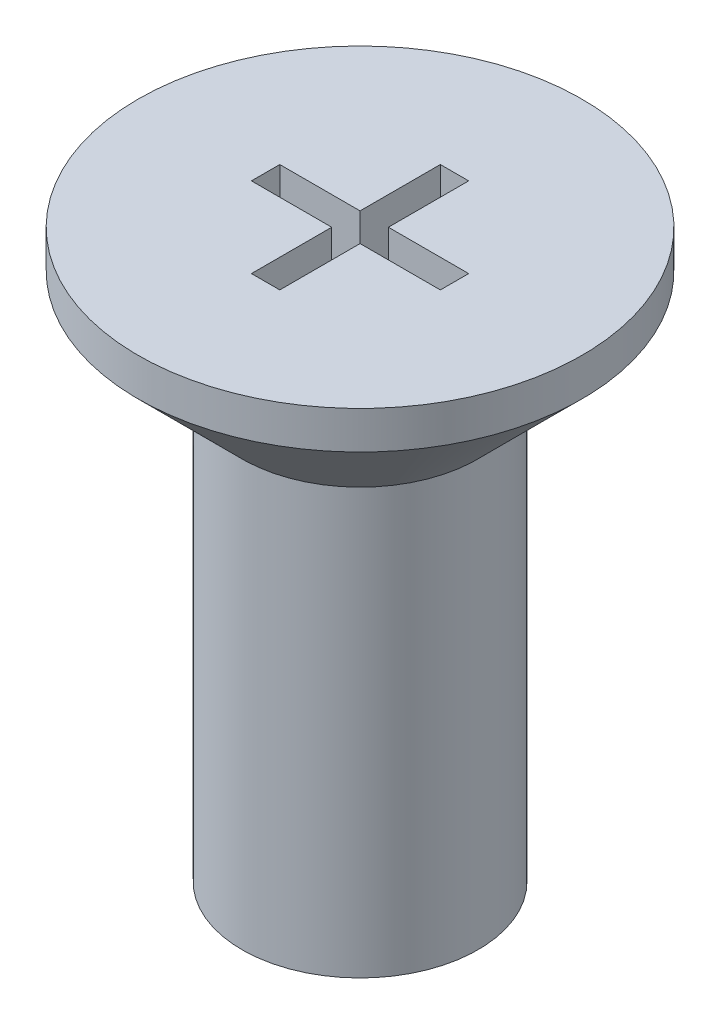
from build123d import *

# Parameters (mm, degrees)
CUT_EXTRUDE1_DEPTH = 1


with BuildPart() as part:
    # Sketch1 → Revolve1 (revolve)
    with BuildSketch(Plane.XY, mode=Mode.PRIVATE) as revolve1_sk:
        Polygon((0, 0), (1.25, 0), (1.25, 4.5), (2.35, 5.6), (2.35, 6), (0, 6), align=None)
    revolve(revolve1_sk.sketch.rotate(Axis((0, 6, 0), (0, -1, 0)), 180), axis=Axis((0, 6, 0), (0, -1, 0)))

    # Sketch2 → Cut-Extrude1 (cut)
    with BuildSketch(Plane(origin=(0, 6, 0), x_dir=(1, 0, 0), z_dir=(0, 1, 0))):
        Polygon((0, 1), (0.15, 1), (0.15, 0.15), (1, 0.15), (1, -0.15), (0.15, -0.15), (0.15, -1), (-0.15, -1), (-0.15, -0.15), (-1, -0.15), (-1, 0.15), (-0.15, 0.15), (-0.15, 1), align=None)
    extrude(amount=-CUT_EXTRUDE1_DEPTH, mode=Mode.SUBTRACT)


solid = part.part
